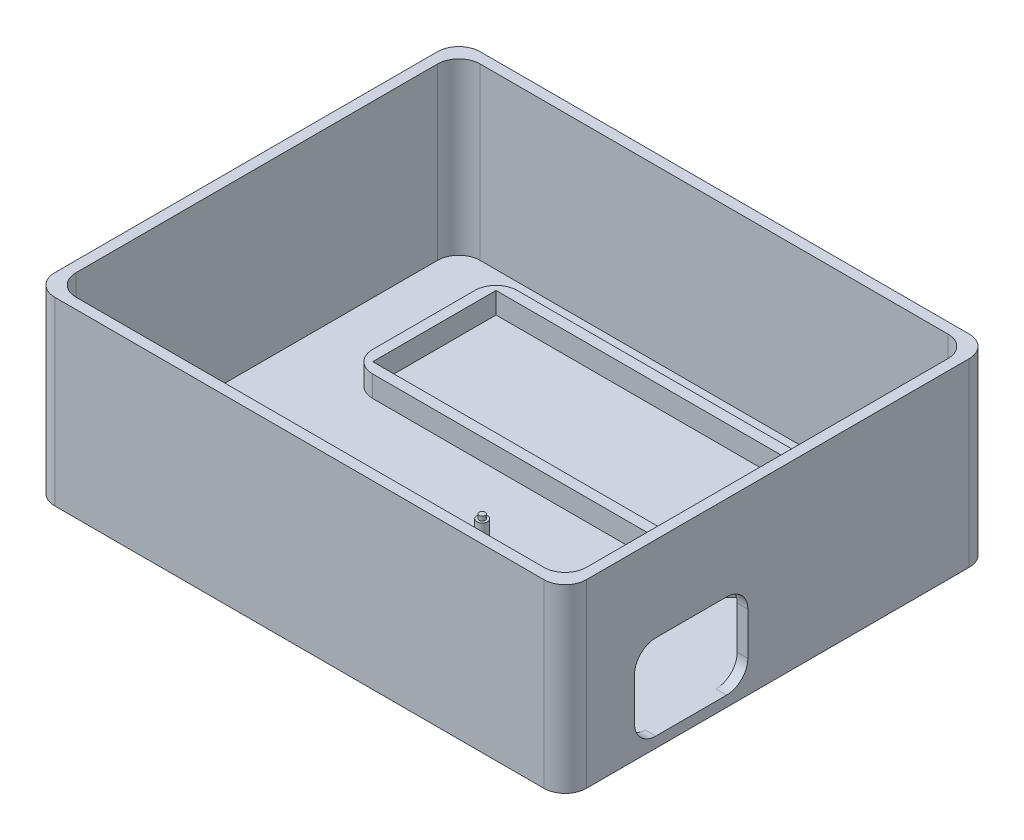
from build123d import *

# Parameters (mm, degrees)
SKETCH2_W           = 250
SKETCH2_H           = 200
BOSS_EXTRUDE1_DEPTH = 5
SKETCH3_W           = 250
SKETCH3_H           = 200
SKETCH3_W_2         = 240
SKETCH3_H_2         = 190
BOSS_EXTRUDE2_DEPTH = 80
SKETCH1_W           = 178
SKETCH1_H           = 68
SKETCH1_W_2         = 168
SKETCH1_H_2         = 58
BOSS_EXTRUDE3_DEPTH = 10
SKETCH7_R           = 2.5
BOSS_EXTRUDE4_DEPTH = 7
SKETCH8_R           = 1.4
BOSS_EXTRUDE5_DEPTH = 2
CUT_EXTRUDE1_REACH  = 284.356
SKETCH4_W           = 53.3
SKETCH4_H           = 40
FILLET1_R           = 10


with BuildPart() as part:
    # Sketch2 → Boss-Extrude1 (new body)
    with BuildSketch(Plane(origin=(0, 0, 0), x_dir=(1, 0, 0), z_dir=(0, 1, 0))):
        Rectangle(SKETCH2_W, SKETCH2_H)
    extrude(amount=BOSS_EXTRUDE1_DEPTH)

    # Sketch3 → Boss-Extrude2 (add)
    with BuildSketch(Plane(origin=(0, 5, 0), x_dir=(1, 0, 0), z_dir=(0, 1, 0))):
        Rectangle(SKETCH3_W, SKETCH3_H)
        Rectangle(SKETCH3_W_2, SKETCH3_H_2, mode=Mode.SUBTRACT)
    extrude(amount=BOSS_EXTRUDE2_DEPTH)

    # Sketch1 → Boss-Extrude3 (add)
    with BuildSketch(Plane(origin=(0, 5, 0), x_dir=(1, 0, 0), z_dir=(0, 1, 0))):
        with Locations((0, 47.5)):
            Rectangle(SKETCH1_W, SKETCH1_H)
        with Locations((0, 47.5)):
            Rectangle(SKETCH1_W_2, SKETCH1_H_2, mode=Mode.SUBTRACT)
    extrude(amount=BOSS_EXTRUDE3_DEPTH)

    # Sketch7 → Boss-Extrude4 (add)
    with BuildSketch(Plane(origin=(0, 5, 0), x_dir=(1, 0, 0), z_dir=(0, 1, 0))):
        with Locations(Location((2.7, -16.7, 0), (0, 0, 90))):
            Circle(SKETCH7_R)
        with Locations(Location((1.4, -64.9, 0), (0, 0, 90))):
            Circle(SKETCH7_R)
        with Locations(Location((53.5, -31.9, 0), (0, 0, 90))):
            Circle(SKETCH7_R)
        with Locations(Location((77.6, -16.7, 0), (0, 0, 90))):
            Circle(SKETCH7_R)
        with Locations(Location((83.95, -64.9, 0), (0, 0, 90))):
            Circle(SKETCH7_R)
        with Locations(Location((53.5, -59.8, 0), (0, 0, 90))):
            Circle(SKETCH7_R)
    extrude(amount=BOSS_EXTRUDE4_DEPTH)

    # Sketch8 → Boss-Extrude5 (add)
    with BuildSketch(Plane(origin=(0, 12, 0), x_dir=(1, 0, 0), z_dir=(0, 1, 0))):
        with Locations(Location((2.7, -16.7, 0), (0, 0, 270))):
            Circle(SKETCH8_R)
        with Locations(Location((53.5, -31.9, 0), (0, 0, 270))):
            Circle(SKETCH8_R)
        with Locations(Location((77.6, -16.7, 0), (0, 0, 270))):
            Circle(SKETCH8_R)
        with Locations(Location((53.5, -59.8, 0), (0, 0, 270))):
            Circle(SKETCH8_R)
        with Locations(Location((1.4, -64.9, 0), (0, 0, 270))):
            Circle(SKETCH8_R)
        with Locations(Location((83.95, -64.9, 0), (0, 0, 270))):
            Circle(SKETCH8_R)
    extrude(amount=BOSS_EXTRUDE5_DEPTH)

    # Sketch4 → Cut-Extrude1 (cut, up to next)
    with BuildSketch(Plane(origin=(125, 0, 0), x_dir=(0, 0, -1), z_dir=(1, 0, 0)), mode=Mode.PRIVATE) as cut_extrude1_sk1:
        with Locations((-40.75, 25)):
            Rectangle(SKETCH4_W, SKETCH4_H)
    cut_extrude1_tool1 = extrude(cut_extrude1_sk1.sketch, amount=-CUT_EXTRUDE1_REACH, mode=Mode.PRIVATE) & part.part
    add(cut_extrude1_tool1.solids().sort_by_distance((125, 25, 40.75))[0], mode=Mode.SUBTRACT)

    # Fillet1
    fillet1_edges = [part.edges().sort_by_distance(p)[0] for p in [
        (122.5, 5, 67.4),
        (122.5, 45, 67.4),
        (122.5, 45, 14.1),
        (122.5, 5, 14.1),
        (120, 45, 95),
        (120, 45, -95),
        (-120, 45, -95),
        (-120, 45, 95),
        (-89, 10, -13.5),
        (89, 10, -13.5),
        (89, 10, -81.5),
        (-89, 10, -81.5),
        (125, 42.5, 100),
        (-125, 42.5, 100),
        (-125, 42.5, -100),
        (125, 42.5, -100),
    ]]
    fillet(fillet1_edges, radius=FILLET1_R)


solid = part.part
